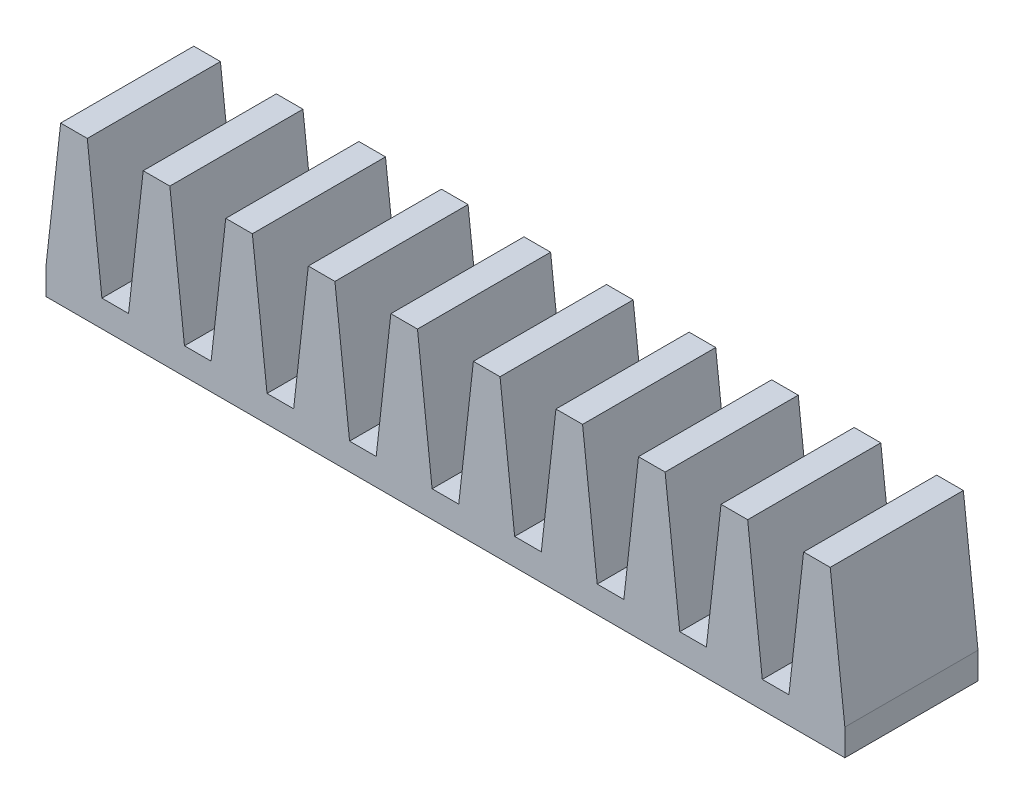
from build123d import *

# Parameters (mm, degrees)
SKETCH3_W           = 30
SKETCH3_H           = 1
BOSS_EXTRUDE1_DEPTH = 5
BOSS_EXTRUDE2_DEPTH = 5
LPATTERN1_COUNT     = 10
LPATTERN1_PITCH     = 3.1


with BuildPart() as part:
    # Sketch3 → Boss-Extrude1 (new body)
    with BuildSketch(Plane.XY):
        with Locations((15, 0.5)):
            Rectangle(SKETCH3_W, SKETCH3_H)
    extrude(amount=BOSS_EXTRUDE1_DEPTH)

    # Sketch5 → Boss-Extrude2 (add)
    with BuildSketch(Plane.XY.offset(5)):
        Polygon((0, 1), (0.55, 5.92), (1.55, 5.92), (2.1, 1), align=None)
    boss_extrude2 = extrude(amount=-BOSS_EXTRUDE2_DEPTH)

    # LPattern1: Boss-Extrude2 ×10
    with Locations(*[(i * LPATTERN1_PITCH, 0, 0) for i in range(1, LPATTERN1_COUNT)]):
        add(boss_extrude2)


solid = part.part
